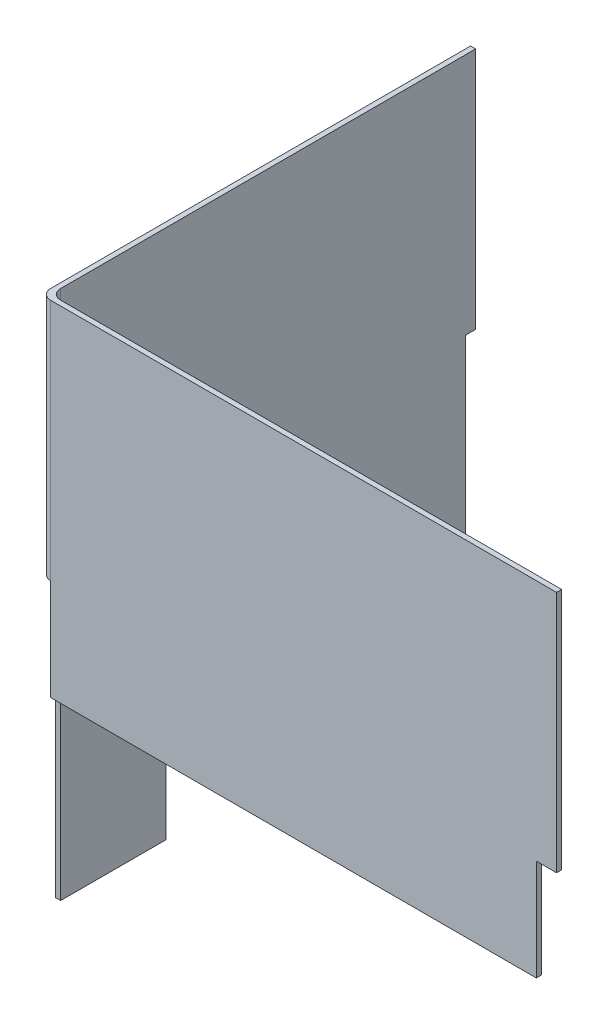
from build123d import *

# Parameters (mm, degrees)
BOSS_EXTRUDE2_DEPTH = 152.4
SKETCH5_W           = 304.8
SKETCH5_H           = 63.5
BOSS_EXTRUDE3_DEPTH = 3.175
BOSS_EXTRUDE4_DEPTH = 3.175


with BuildPart() as part:
    # Sketch4 → Boss-Extrude2 (new body)
    with BuildSketch(Plane(origin=(0, 0, 0), x_dir=(1, 0, 0), z_dir=(0, 1, 0))):
        with BuildLine():
            Line((-149.225, -127), (165.1, -127))
            Line((165.1, -127), (165.1, -130.175))
            Line((165.1, -130.175), (-152.4, -130.175))
            ThreePointArc((-152.4, -130.175), (-156.890128061, -128.315128061), (-158.75, -123.825))
            Line((-158.75, -123.825), (-158.75, 139.7))
            Line((-158.75, 139.7), (-155.575, 139.7))
            Line((-155.575, 139.7), (-155.575, -120.65))
            ThreePointArc((-155.575, -120.65), (-153.715128061, -125.140128061), (-149.225, -127))
        make_face()
    extrude(amount=BOSS_EXTRUDE2_DEPTH)

    # Sketch5 → Boss-Extrude3 (add)
    with BuildSketch(Plane.XY.offset(130.175)):
        with Locations((0, -31.75)):
            Rectangle(SKETCH5_W, SKETCH5_H)
    extrude(amount=-BOSS_EXTRUDE3_DEPTH)

    # Sketch6 → Boss-Extrude4 (add)
    with BuildSketch(Plane.ZY.offset(158.75)):
        with BuildLine():
            Line((-133.35, -180.1876), (-133.35, 0))
            Line((-133.35, 0), (120.65, 0))
            Line((120.65, 0), (120.65, -180.1876))
            Line((120.65, -180.1876), (54.61, -180.1876))
            Line((54.61, -180.1876), (54.61, -139.7))
            ThreePointArc((54.61, -139.7), (-6.35, -78.74), (-67.31, -139.7))
            Line((-67.31, -139.7), (-67.31, -180.1876))
            Line((-67.31, -180.1876), (-133.35, -180.1876))
        make_face()
    extrude(amount=-BOSS_EXTRUDE4_DEPTH)


solid = part.part
